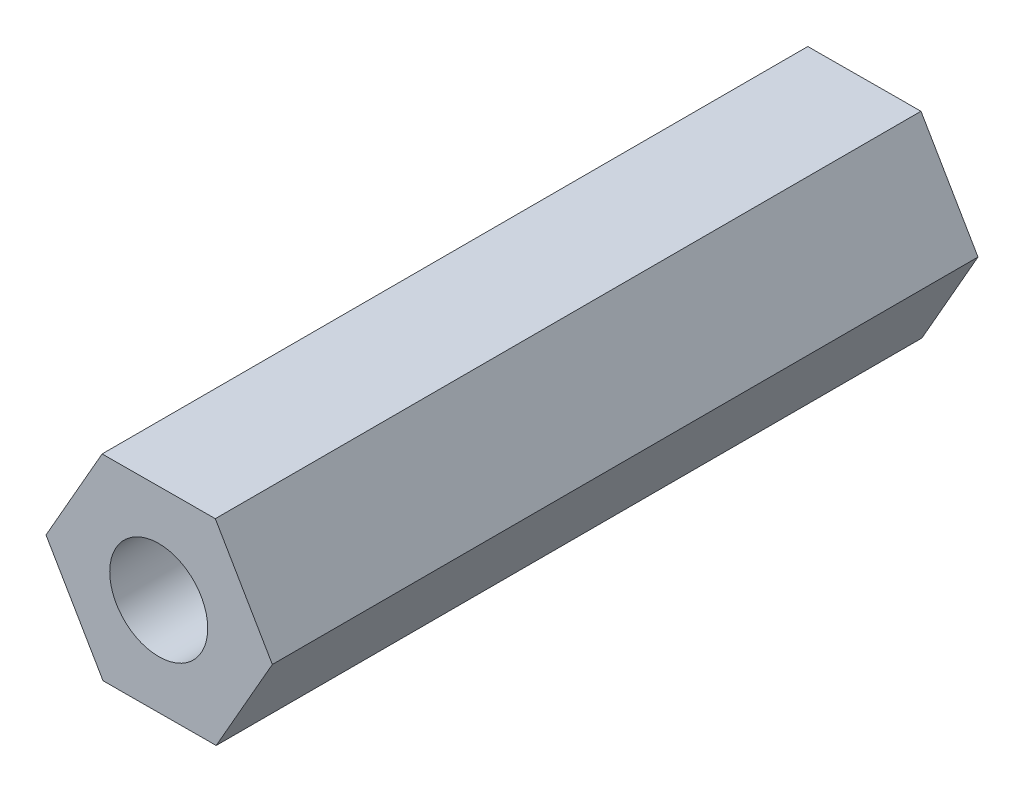
from build123d import *

# Parameters (mm, degrees)
EXTRUDE_1_DEPTH     = 18
SKETCH_2_R          = 1.25
CUT_EXTRUDE_1_DEPTH = 25


with BuildPart() as part:
    # 草图1 → 凸台-拉伸1 (new body)
    with BuildSketch(Plane.XY):
        Polygon((-66.857368384, 15.168882337), (-65.425196312, 17.675317354), (-66.879746674, 20.168832258), (-69.766469106, 20.155912147), (-71.198641178, 17.649477131), (-69.744090817, 15.155962226), align=None)
    extrude(amount=EXTRUDE_1_DEPTH)

    # 草图2 → 切除-拉伸1 (cut)
    with BuildSketch(Plane(origin=(0, 0, 0), x_dir=(-1, 0, 0), z_dir=(0, 0, -1))):
        with Locations((68.32310789, 17.649477131)):
            Circle(SKETCH_2_R)
    extrude(amount=-CUT_EXTRUDE_1_DEPTH, mode=Mode.SUBTRACT)


solid = part.part
